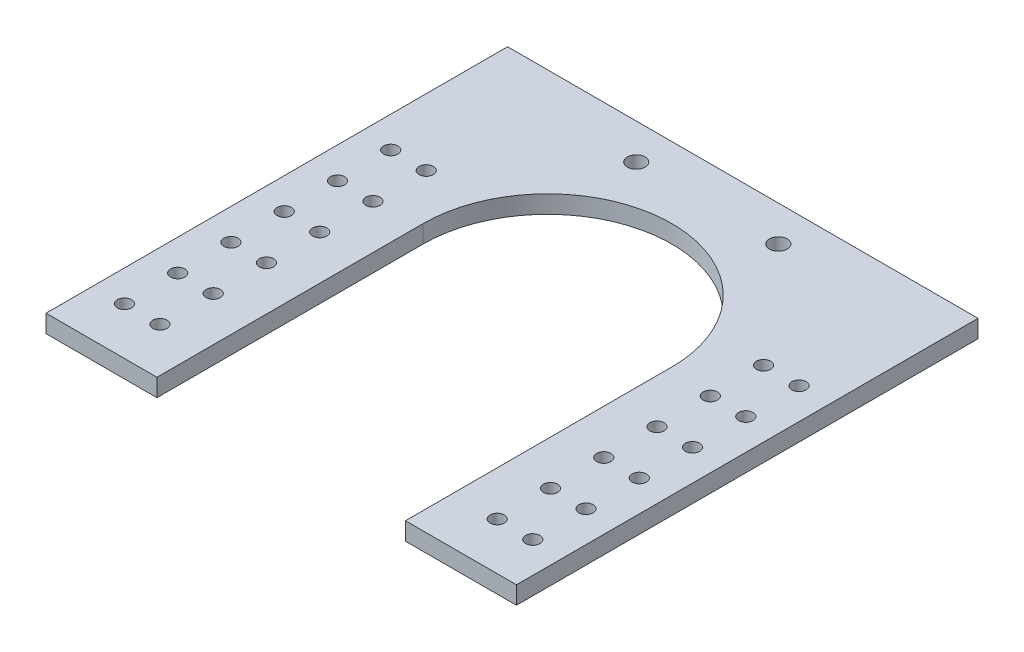
from build123d import *

# Parameters (mm, degrees)
SKETCH1_W                        = 168.275
SKETCH1_H                        = 165.1
BOSS_EXTRUDE1_DEPTH              = 3.175
CUT_EXTRUDE1_REACH               = 120.042
SKETCH2_R                        = 44.45
F_1_4_0_25_DIAMETER_HOLE1_D      = 6.35
F_1_4_0_25_DIAMETER_HOLE1_DEPTH  = 25.4
F_1_4_0_25_DIAMETER_HOLE1_TIP    = 1.907732465
F_1_4_20_TAPPED_HOLE1_AT_2_COUNT = 2
F_1_4_20_TAPPED_HOLE1_AT_2_PITCH = 12.7
LPATTERN1_COUNT                  = 6
LPATTERN1_PITCH                  = 19.05


with BuildPart() as part:
    # Sketch1 → Boss-Extrude1 (new, symmetric)
    with BuildSketch(Plane(origin=(0, 0, 0), x_dir=(1, 0, 0), z_dir=(0, 1, 0))):
        Rectangle(SKETCH1_W, SKETCH1_H)
    extrude(amount=BOSS_EXTRUDE1_DEPTH, both=True)

    # Sketch2 → Cut-Extrude1 (cut, up to next)
    with BuildSketch(Plane(origin=(0, 3.175, 0), x_dir=(1, 0, 0), z_dir=(0, 1, 0)), mode=Mode.PRIVATE) as cut_extrude1_sk1:
        with Locations((0, 12.7)):
            Circle(SKETCH2_R)
    cut_extrude1_tool1 = extrude(cut_extrude1_sk1.sketch, amount=-CUT_EXTRUDE1_REACH, mode=Mode.PRIVATE) & part.part
    # Sketch2 → Cut-Extrude1 (cut, up to next)
    with BuildSketch(Plane(origin=(0, 3.175, 0), x_dir=(1, 0, 0), z_dir=(0, 1, 0)), mode=Mode.PRIVATE) as cut_extrude1_sk2:
        with BuildLine():
            Line((44.45, -82.55), (44.45, 12.7))
            ThreePointArc((44.45, 12.7), (0, -31.75), (-44.45, 12.7))
            Line((-44.45, 12.7), (-44.45, -82.55))
            Line((-44.45, -82.55), (44.45, -82.55))
        make_face()
    cut_extrude1_tool2 = extrude(cut_extrude1_sk2.sketch, amount=-CUT_EXTRUDE1_REACH, mode=Mode.PRIVATE) & part.part
    add(cut_extrude1_tool1.solids().sort_by_distance((0, 3.175, -12.7))[0], mode=Mode.SUBTRACT)
    add(cut_extrude1_tool2.solids().sort_by_distance((0, 3.175, 51.564855))[0], mode=Mode.SUBTRACT)

    # 1/4 (0.25) Diameter Hole1
    with Locations(Plane(origin=(0, 3.175, 0), x_dir=(1, 0, 0), z_dir=(0, 1, 0))):
        with Locations((-25.4, 69.85), (25.4, 69.85)):
            Hole(F_1_4_0_25_DIAMETER_HOLE1_D / 2, depth=F_1_4_0_25_DIAMETER_HOLE1_DEPTH)
            with Locations((0, 0, -(F_1_4_0_25_DIAMETER_HOLE1_DEPTH + F_1_4_0_25_DIAMETER_HOLE1_TIP / 2))):  # 118° drill point
                Cone(0, F_1_4_0_25_DIAMETER_HOLE1_D / 2, F_1_4_0_25_DIAMETER_HOLE1_TIP, mode=Mode.SUBTRACT)

    # Sketch10 → 1/4-20 Tapped Hole1 (revolve, cut)
    with BuildSketch(Plane(origin=(-73.025, 3.175, 65.603705108), x_dir=(0, 0, 1), z_dir=(1, 0, 0))):
        Polygon((0, 0), (0, 26.933816902), (2.5527, 25.4), (2.5527, 0), align=None)
    f_1_4_20_tapped_hole1 = revolve(axis=Axis((-73.025, 9.525, 65.603705108), (0, -1, 0)), mode=Mode.SUBTRACT)

    # 1/4-20 Tapped Hole1 at 2: 1/4-20 Tapped Hole1 ×2
    with Locations(*[(i * F_1_4_20_TAPPED_HOLE1_AT_2_PITCH, 0, 0) for i in range(1, F_1_4_20_TAPPED_HOLE1_AT_2_COUNT)]):
        add(f_1_4_20_tapped_hole1, mode=Mode.SUBTRACT)

    # LPattern1: 1/4-20 Tapped Hole1 ×6
    with Locations(*[(0, 0, -i * LPATTERN1_PITCH) for i in range(1, LPATTERN1_COUNT)]):
        add(f_1_4_20_tapped_hole1, mode=Mode.SUBTRACT)

    # LPattern1 copy 1 sketch → LPattern1 copy 1 (revolve, cut)
    with BuildSketch(Plane(origin=(-60.325, 3.175, 46.553705108), x_dir=(0, 0, 1), z_dir=(1, 0, 0))):
        Polygon((0, 0), (0, 26.933816902), (2.5527, 25.4), (2.5527, 0), align=None)
    revolve(axis=Axis((-60.325, 9.525, 46.553705108), (0, -1, 0)), mode=Mode.SUBTRACT)

    # LPattern1 copy 2 sketch → LPattern1 copy 2 (revolve, cut)
    with BuildSketch(Plane(origin=(-60.325, 3.175, 27.503705108), x_dir=(0, 0, 1), z_dir=(1, 0, 0))):
        Polygon((0, 0), (0, 26.933816902), (2.5527, 25.4), (2.5527, 0), align=None)
    revolve(axis=Axis((-60.325, 9.525, 27.503705108), (0, -1, 0)), mode=Mode.SUBTRACT)

    # LPattern1 copy 3 sketch → LPattern1 copy 3 (revolve, cut)
    with BuildSketch(Plane(origin=(-60.325, 3.175, 8.453705108), x_dir=(0, 0, 1), z_dir=(1, 0, 0))):
        Polygon((0, 0), (0, 26.933816902), (2.5527, 25.4), (2.5527, 0), align=None)
    revolve(axis=Axis((-60.325, 9.525, 8.453705108), (0, -1, 0)), mode=Mode.SUBTRACT)

    # LPattern1 copy 4 sketch → LPattern1 copy 4 (revolve, cut)
    with BuildSketch(Plane(origin=(-60.325, 3.175, -10.596294892), x_dir=(0, 0, 1), z_dir=(1, 0, 0))):
        Polygon((0, 0), (0, 26.933816902), (2.5527, 25.4), (2.5527, 0), align=None)
    revolve(axis=Axis((-60.325, 9.525, -10.596294892), (0, -1, 0)), mode=Mode.SUBTRACT)

    # LPattern1 copy 5 sketch → LPattern1 copy 5 (revolve, cut)
    with BuildSketch(Plane(origin=(-60.325, 3.175, -29.646294892), x_dir=(0, 0, 1), z_dir=(1, 0, 0))):
        Polygon((0, 0), (0, 26.933816902), (2.5527, 25.4), (2.5527, 0), align=None)
    revolve(axis=Axis((-60.325, 9.525, -29.646294892), (0, -1, 0)), mode=Mode.SUBTRACT)

    # Mirror1: 1/4-20 Tapped Hole1 across plane
    add(f_1_4_20_tapped_hole1.mirror(Plane(origin=(0, 0, 0), x_dir=(0, 0, 1), z_dir=(1, 0, 0))), mode=Mode.SUBTRACT)

    # Mirror1 copy 1 sketch → Mirror1 copy 1 (revolve, cut)
    with BuildSketch(Plane(origin=(60.325, 3.175, 65.603705108), x_dir=(0, 0, 1), z_dir=(-1, 0, 0))):
        Polygon((0, 0), (0, -26.933816902), (2.5527, -25.4), (2.5527, 0), align=None)
    revolve(axis=Axis((60.325, 9.525, 65.603705108), (0, 1, 0)), mode=Mode.SUBTRACT)

    # Mirror1 copy 2 sketch → Mirror1 copy 2 (revolve, cut)
    with BuildSketch(Plane(origin=(73.025, 3.175, 46.553705108), x_dir=(0, 0, 1), z_dir=(-1, 0, 0))):
        Polygon((0, 0), (0, -26.933816902), (2.5527, -25.4), (2.5527, 0), align=None)
    revolve(axis=Axis((73.025, 9.525, 46.553705108), (0, 1, 0)), mode=Mode.SUBTRACT)

    # Mirror1 copy 3 sketch → Mirror1 copy 3 (revolve, cut)
    with BuildSketch(Plane(origin=(73.025, 3.175, 27.503705108), x_dir=(0, 0, 1), z_dir=(-1, 0, 0))):
        Polygon((0, 0), (0, -26.933816902), (2.5527, -25.4), (2.5527, 0), align=None)
    revolve(axis=Axis((73.025, 9.525, 27.503705108), (0, 1, 0)), mode=Mode.SUBTRACT)

    # Mirror1 copy 4 sketch → Mirror1 copy 4 (revolve, cut)
    with BuildSketch(Plane(origin=(73.025, 3.175, 8.453705108), x_dir=(0, 0, 1), z_dir=(-1, 0, 0))):
        Polygon((0, 0), (0, -26.933816902), (2.5527, -25.4), (2.5527, 0), align=None)
    revolve(axis=Axis((73.025, 9.525, 8.453705108), (0, 1, 0)), mode=Mode.SUBTRACT)

    # Mirror1 copy 5 sketch → Mirror1 copy 5 (revolve, cut)
    with BuildSketch(Plane(origin=(73.025, 3.175, -10.596294892), x_dir=(0, 0, 1), z_dir=(-1, 0, 0))):
        Polygon((0, 0), (0, -26.933816902), (2.5527, -25.4), (2.5527, 0), align=None)
    revolve(axis=Axis((73.025, 9.525, -10.596294892), (0, 1, 0)), mode=Mode.SUBTRACT)

    # Mirror1 copy 6 sketch → Mirror1 copy 6 (revolve, cut)
    with BuildSketch(Plane(origin=(73.025, 3.175, -29.646294892), x_dir=(0, 0, 1), z_dir=(-1, 0, 0))):
        Polygon((0, 0), (0, -26.933816902), (2.5527, -25.4), (2.5527, 0), align=None)
    revolve(axis=Axis((73.025, 9.525, -29.646294892), (0, 1, 0)), mode=Mode.SUBTRACT)

    # Mirror1 copy 7 sketch → Mirror1 copy 7 (revolve, cut)
    with BuildSketch(Plane(origin=(60.325, 3.175, 46.553705108), x_dir=(0, 0, 1), z_dir=(-1, 0, 0))):
        Polygon((0, 0), (0, -26.933816902), (2.5527, -25.4), (2.5527, 0), align=None)
    revolve(axis=Axis((60.325, 9.525, 46.553705108), (0, 1, 0)), mode=Mode.SUBTRACT)

    # Mirror1 copy 8 sketch → Mirror1 copy 8 (revolve, cut)
    with BuildSketch(Plane(origin=(60.325, 3.175, 27.503705108), x_dir=(0, 0, 1), z_dir=(-1, 0, 0))):
        Polygon((0, 0), (0, -26.933816902), (2.5527, -25.4), (2.5527, 0), align=None)
    revolve(axis=Axis((60.325, 9.525, 27.503705108), (0, 1, 0)), mode=Mode.SUBTRACT)

    # Mirror1 copy 9 sketch → Mirror1 copy 9 (revolve, cut)
    with BuildSketch(Plane(origin=(60.325, 3.175, 8.453705108), x_dir=(0, 0, 1), z_dir=(-1, 0, 0))):
        Polygon((0, 0), (0, -26.933816902), (2.5527, -25.4), (2.5527, 0), align=None)
    revolve(axis=Axis((60.325, 9.525, 8.453705108), (0, 1, 0)), mode=Mode.SUBTRACT)

    # Mirror1 copy 10 sketch → Mirror1 copy 10 (revolve, cut)
    with BuildSketch(Plane(origin=(60.325, 3.175, -10.596294892), x_dir=(0, 0, 1), z_dir=(-1, 0, 0))):
        Polygon((0, 0), (0, -26.933816902), (2.5527, -25.4), (2.5527, 0), align=None)
    revolve(axis=Axis((60.325, 9.525, -10.596294892), (0, 1, 0)), mode=Mode.SUBTRACT)

    # Mirror1 copy 11 sketch → Mirror1 copy 11 (revolve, cut)
    with BuildSketch(Plane(origin=(60.325, 3.175, -29.646294892), x_dir=(0, 0, 1), z_dir=(-1, 0, 0))):
        Polygon((0, 0), (0, -26.933816902), (2.5527, -25.4), (2.5527, 0), align=None)
    revolve(axis=Axis((60.325, 9.525, -29.646294892), (0, 1, 0)), mode=Mode.SUBTRACT)


solid = part.part
